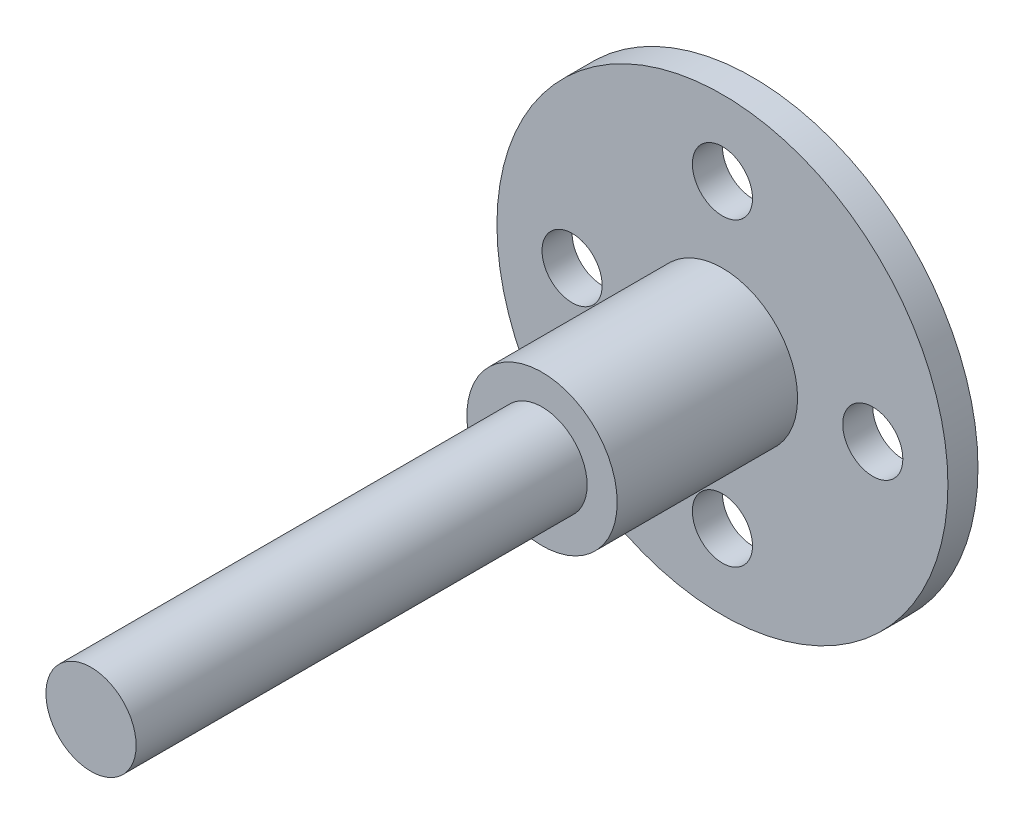
from build123d import *

# Parameters (mm, degrees)
SKETCH1_R           = 15
BOSS_EXTRUDE1_DEPTH = 2
SKETCH2_R           = 5
BOSS_EXTRUDE2_DEPTH = 12
SKETCH3_R           = 2
CUT_EXTRUDE1_DEPTH  = 6
SKETCH4_R           = 3
BOSS_EXTRUDE3_DEPTH = 30


with BuildPart() as part:
    # Sketch1 → Boss-Extrude1 (new body)
    with BuildSketch(Plane.XY):
        Circle(SKETCH1_R)
    extrude(amount=BOSS_EXTRUDE1_DEPTH)

    # Sketch2 → Boss-Extrude2 (add)
    with BuildSketch(Plane.XY.offset(2)):
        Circle(SKETCH2_R)
    extrude(amount=BOSS_EXTRUDE2_DEPTH)

    # Sketch3 → Cut-Extrude1 (cut)
    with BuildSketch(Plane.XY.offset(2)):
        with Locations((0, 10)):
            Circle(SKETCH3_R)
        with Locations((10, 0)):
            Circle(SKETCH3_R)
        with Locations((0, -10)):
            Circle(SKETCH3_R)
        with Locations((-10, 0)):
            Circle(SKETCH3_R)
    extrude(amount=-CUT_EXTRUDE1_DEPTH, mode=Mode.SUBTRACT)

    # Sketch4 → Boss-Extrude3 (add)
    with BuildSketch(Plane.XY.offset(14)):
        Circle(SKETCH4_R)
    extrude(amount=BOSS_EXTRUDE3_DEPTH)


solid = part.part
